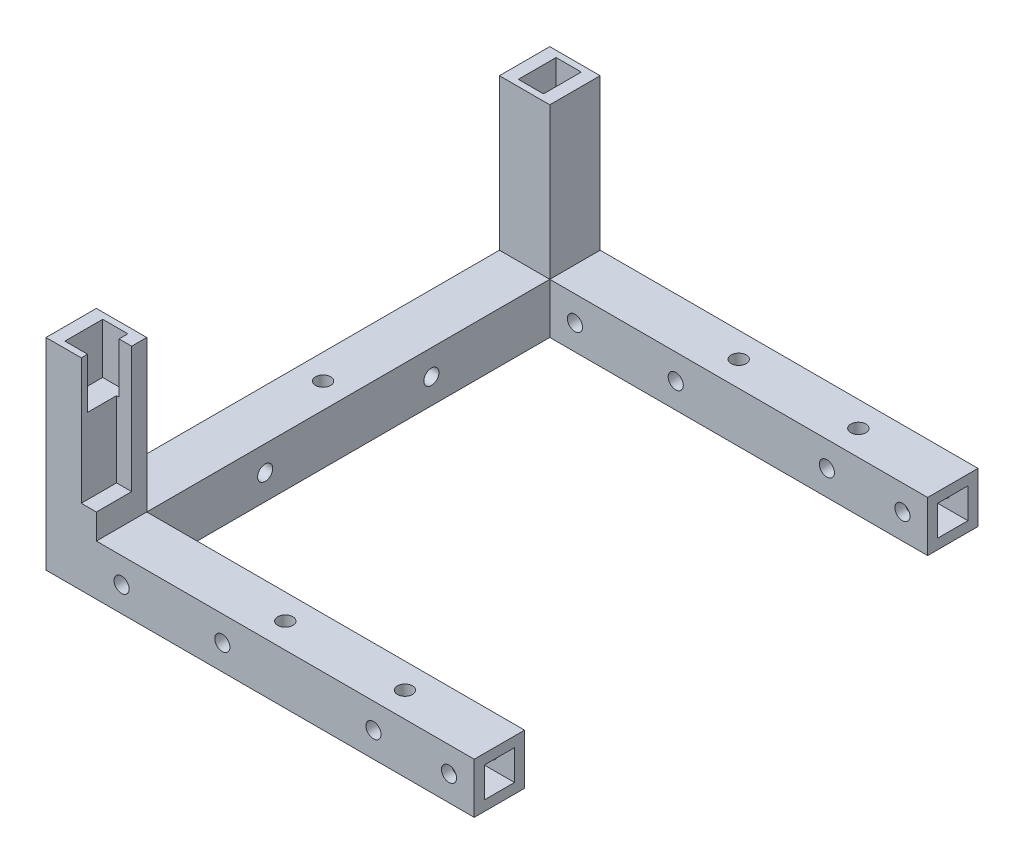
from build123d import *

# Parameters (mm, degrees)
SKETCH1_W               = 320
SKETCH1_H               = 200
SKETCH1_W_2             = 280
SKETCH1_H_2             = 160
BOSS_EXTRUDE1_DEPTH     = 20
SKETCH2_W               = 150
SKETCH2_H               = 200
CUT_EXTRUDE1_DEPTH      = 20
SKETCH3_W               = 20
SKETCH3_H               = 20
BOSS_EXTRUDE2_DEPTH     = 60
SKETCH4_W               = 10
SKETCH4_H               = 15
CUT_EXTRUDE2_DEPTH      = 20
SKETCH5_W               = 12
SKETCH5_H               = 12
CUT_EXTRUDE3_DEPTH      = 22
CUT_EXTRUDE5_DEPTH      = 275.40845468
CUT_EXTRUDE5_DEPTH_BACK = 275.40845468
SKETCH8_R               = 3
SKETCH10_R              = 3
CUT_EXTRUDE6_DEPTH      = 30
SKETCH11_W              = 14
SKETCH11_H              = 50
CUT_EXTRUDE7_DEPTH      = 6
SKETCH12_R              = 3
CUT_EXTRUDE8_DEPTH      = 20


with BuildPart() as part:
    # Sketch1 → Boss-Extrude1 (new body)
    with BuildSketch(Plane(origin=(0, 0, 0), x_dir=(1, 0, 0), z_dir=(0, 1, 0))):
        with Locations((160, 100)):
            Rectangle(SKETCH1_W, SKETCH1_H)
        with Locations((160, 100)):
            Rectangle(SKETCH1_W_2, SKETCH1_H_2, mode=Mode.SUBTRACT)
    extrude(amount=BOSS_EXTRUDE1_DEPTH)

    # Sketch2 → Cut-Extrude1 (cut)
    with BuildSketch(Plane(origin=(0, 20, 0), x_dir=(1, 0, 0), z_dir=(0, 1, 0))):
        with Locations((245, 100)):
            Rectangle(SKETCH2_W, SKETCH2_H)
    extrude(amount=-CUT_EXTRUDE1_DEPTH, mode=Mode.SUBTRACT)

    # Sketch3 → Boss-Extrude2 (add)
    with BuildSketch(Plane(origin=(0, 20, 0), x_dir=(1, 0, 0), z_dir=(0, 1, 0))):
        with Locations((10, 10)):
            Rectangle(SKETCH3_W, SKETCH3_H)
        with Locations((10, 190)):
            Rectangle(SKETCH3_W, SKETCH3_H)
    extrude(amount=BOSS_EXTRUDE2_DEPTH)

    # Sketch4 → Cut-Extrude2 (cut)
    with BuildSketch(Plane(origin=(0, 80, 0), x_dir=(1, 0, 0), z_dir=(0, 1, 0))):
        with Locations((10, 10)):
            Rectangle(SKETCH4_W, SKETCH4_H)
        with Locations((10, 190)):
            Rectangle(SKETCH4_W, SKETCH4_H)
    extrude(amount=-CUT_EXTRUDE2_DEPTH, mode=Mode.SUBTRACT)

    # Sketch5 → Cut-Extrude3 (cut)
    with BuildSketch(Plane(origin=(170, 0, 0), x_dir=(0, 0, -1), z_dir=(1, 0, 0))):
        with Locations((10, 10)):
            Rectangle(SKETCH5_W, SKETCH5_H)
        with Locations((190, 10)):
            Rectangle(SKETCH5_W, SKETCH5_H)
    extrude(amount=-CUT_EXTRUDE3_DEPTH, mode=Mode.SUBTRACT)

    # Sketch8 → Cut-Extrude5 (cut, two sides: drawn at the far end of the back side and taken through both)
    with BuildSketch(Plane(origin=(0, 0, -200), x_dir=(-1, 0, 0), z_dir=(0, 0, -1)).offset(-CUT_EXTRUDE5_DEPTH_BACK)):
        with Locations((-30, 10)):
            Circle(SKETCH8_R)
        with Locations((-160, 10)):
            Circle(SKETCH8_R)
        with Locations((-70, 10)):
            Circle(SKETCH8_R)
        with Locations((-130, 10)):
            Circle(SKETCH8_R)
    extrude(amount=CUT_EXTRUDE5_DEPTH + CUT_EXTRUDE5_DEPTH_BACK, mode=Mode.SUBTRACT)

    # Sketch10 → Cut-Extrude6 (cut)
    with BuildSketch(Plane.XZ):
        with Locations(Location((132.5, -10, 0), (0, 0, 270))):
            Circle(SKETCH10_R)
        with Locations(Location((85, -10, 0), (0, 0, 270))):
            Circle(SKETCH10_R)
        with Locations(Location((10, -100, 0), (0, 0, 270))):
            Circle(SKETCH10_R)
        with Locations(Location((132.5, -190, 0), (0, 0, 270))):
            Circle(SKETCH10_R)
        with Locations(Location((85, -190, 0), (0, 0, 270))):
            Circle(SKETCH10_R)
    extrude(amount=-CUT_EXTRUDE6_DEPTH, mode=Mode.SUBTRACT)

    # Sketch11 → Cut-Extrude7 (cut)
    with BuildSketch(Plane(origin=(20, 0, 0), x_dir=(0, 0, -1), z_dir=(1, 0, 0))):
        with Locations((7, 55)):
            Rectangle(SKETCH11_W, SKETCH11_H)
    extrude(amount=-CUT_EXTRUDE7_DEPTH, mode=Mode.SUBTRACT)

    # Sketch12 → Cut-Extrude8 (cut)
    with BuildSketch(Plane.ZY):
        with Locations((-133, 10)):
            Circle(SKETCH12_R)
        with Locations((-67, 10)):
            Circle(SKETCH12_R)
    extrude(amount=-CUT_EXTRUDE8_DEPTH, mode=Mode.SUBTRACT)


solid = part.part
